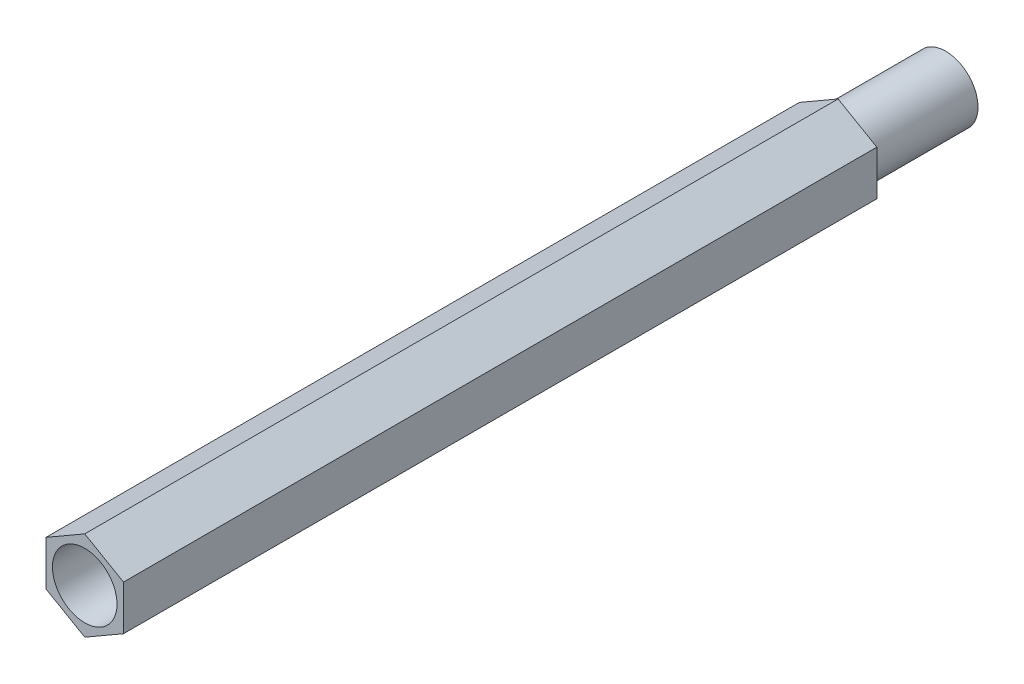
from build123d import *

# Parameters (mm, degrees)
SKETCH_1_R      = 1.5
EXTRUDE_1_DEPTH = 35
SKETCH_2_R      = 1.5
EXTRUDE_2_DEPTH = 5


with BuildPart() as part:
    # 草图1 → 凸台-拉伸1 (new body)
    with BuildSketch(Plane.XY):
        Polygon((0, 2.078460969), (-1.8, 1.039230485), (-1.8, -1.039230485), (0, -2.078460969), (1.8, -1.039230485), (1.8, 1.039230485), align=None)
        Circle(SKETCH_1_R, mode=Mode.SUBTRACT)
    extrude(amount=EXTRUDE_1_DEPTH)

    # 草图2 → 凸台-拉伸2 (add, symmetric)
    with BuildSketch(Plane(origin=(0, 0, 0), x_dir=(-1, 0, 0), z_dir=(0, 0, -1))):
        Circle(SKETCH_2_R)
    extrude(amount=EXTRUDE_2_DEPTH, both=True)


solid = part.part
